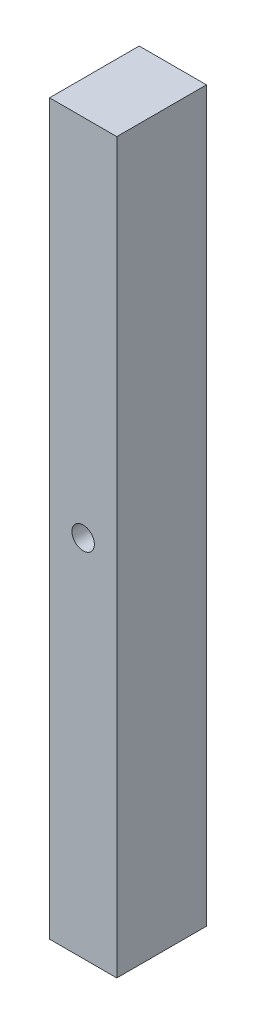
from build123d import *

# Parameters (mm, degrees)
SKETCH1_W           = 6
SKETCH1_H           = 65
SKETCH1_R           = 1
BOSS_EXTRUDE1_DEPTH = 8


with BuildPart() as part:
    # Sketch1 → Boss-Extrude1 (new body)
    with BuildSketch(Plane.XY):
        with Locations((1.31122449, 20.56122449)):
            Rectangle(SKETCH1_W, SKETCH1_H)
        with Locations((1.31122449, 20.56122449)):
            Circle(SKETCH1_R, mode=Mode.SUBTRACT)
    extrude(amount=BOSS_EXTRUDE1_DEPTH)


solid = part.part
